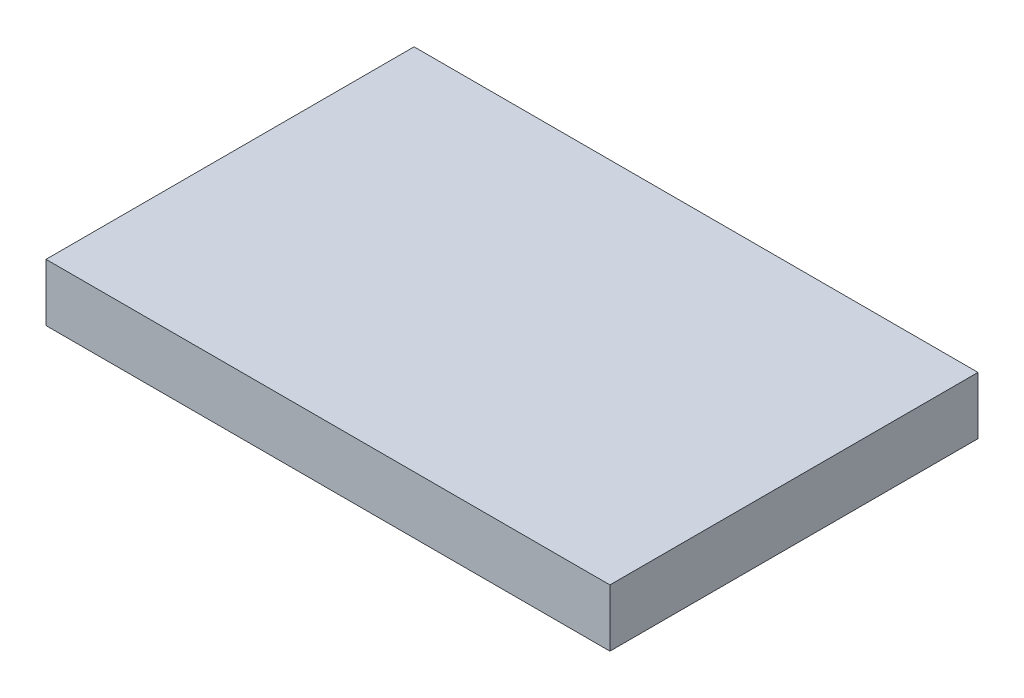
from build123d import *

# Parameters (mm, degrees)
SKETCH1_W           = 83.5
SKETCH1_H           = 54.5
BOSS_EXTRUDE1_DEPTH = 8.5


with BuildPart() as part:
    # Sketch1 → Boss-Extrude1 (new body)
    with BuildSketch(Plane(origin=(0, 0, 0), x_dir=(1, 0, 0), z_dir=(0, 1, 0))):
        Rectangle(SKETCH1_W, SKETCH1_H)
    extrude(amount=BOSS_EXTRUDE1_DEPTH)


solid = part.part
